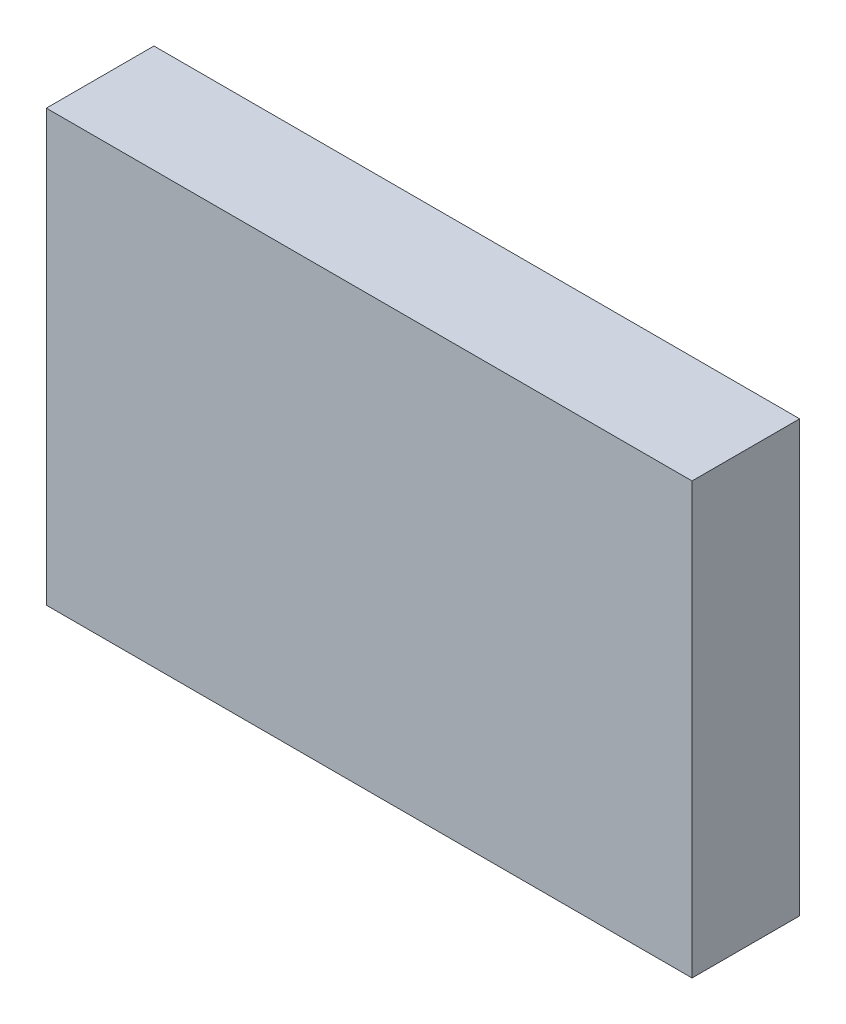
from build123d import *

# Parameters (mm, degrees)
SKETCH3_W           = 30
SKETCH3_H           = 20
BOSS_EXTRUDE1_DEPTH = 5


with BuildPart() as part:
    # Sketch3 → Boss-Extrude1 (new body)
    with BuildSketch(Plane.XY.offset(17)):
        Rectangle(SKETCH3_W, SKETCH3_H)
    extrude(amount=BOSS_EXTRUDE1_DEPTH)


solid = part.part
